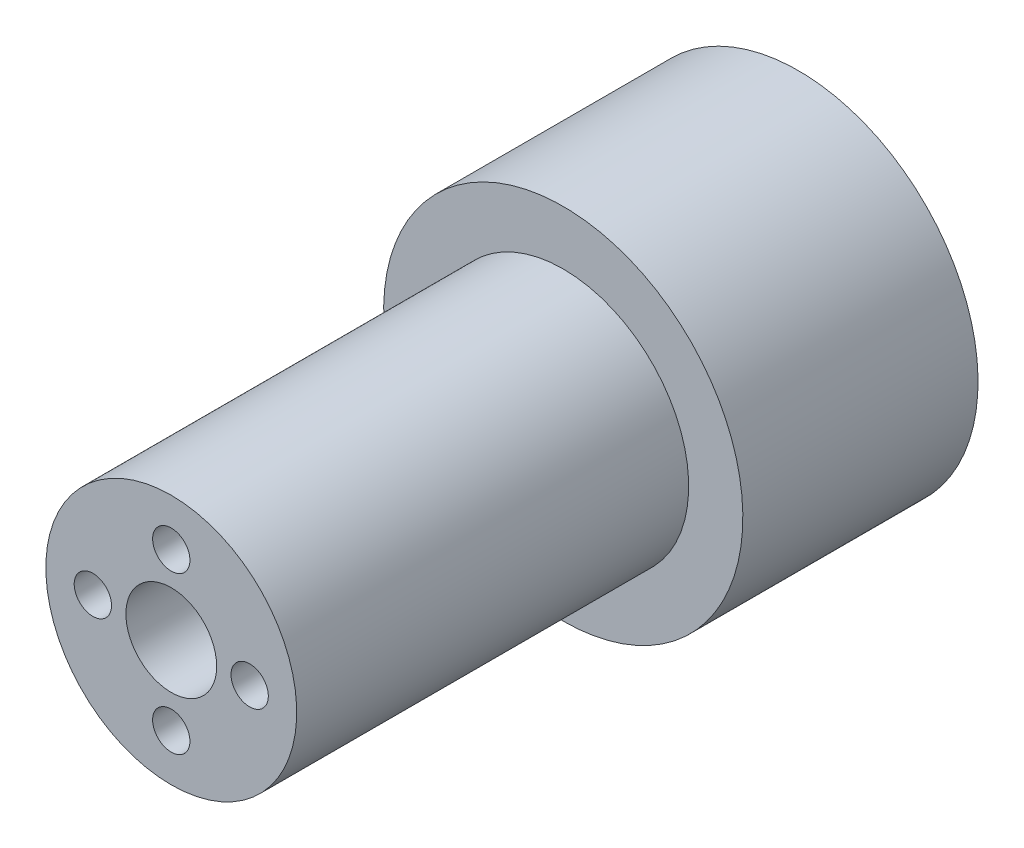
from build123d import *

# Parameters (mm, degrees)
SKETCH1_3_R        = 1.190625
CUT_EXTRUDE1_DEPTH = 8
SKETCH1_R          = 2.8956
CUT_EXTRUDE2_DEPTH = 16


with BuildPart() as part:
    # Sketch2 → Revolve1 (revolve)
    with BuildSketch(Plane.YZ):
        Polygon((0, 0), (0, -40), (11.455, -40), (11.455, -25), (8, -25), (8, 0), align=None)
    revolve(axis=Axis((0, 0, 0), (0, 0, -1)))

    # Sketch1<3> → Cut-Extrude1 (cut)
    with BuildSketch(Plane(origin=(0, 0, 0), x_dir=(0, 1, 0), z_dir=(0, 0, 1))):
        with Locations((0, 5)):
            Circle(SKETCH1_3_R)
        with Locations((-5, 0)):
            Circle(SKETCH1_3_R)
        with Locations((5, 0)):
            Circle(SKETCH1_3_R)
        with Locations((0, -5)):
            Circle(SKETCH1_3_R)
    extrude(amount=-CUT_EXTRUDE1_DEPTH, mode=Mode.SUBTRACT)

    # Sketch1 → Cut-Extrude2 (cut)
    with BuildSketch(Plane(origin=(0, 0, 0), x_dir=(0, 1, 0), z_dir=(0, 0, 1))):
        Circle(SKETCH1_R)
    extrude(amount=-CUT_EXTRUDE2_DEPTH, mode=Mode.SUBTRACT)


solid = part.part
